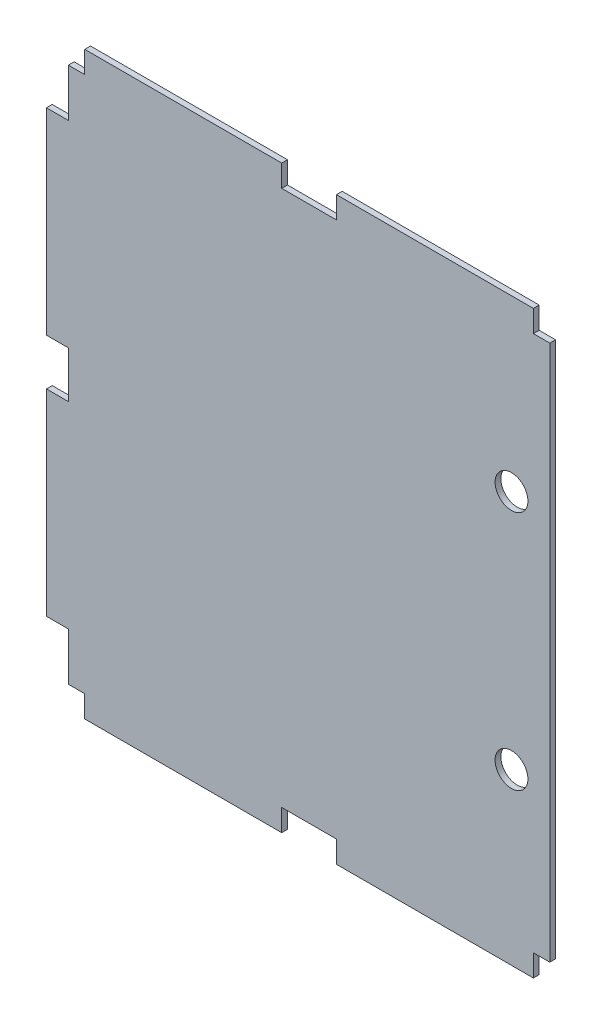
from build123d import *

# Parameters (mm, degrees)
SKETCH1_W           = 279.4
SKETCH1_H           = 311.15
SKETCH1_W_2         = 114.3
SKETCH1_H_2         = 12.7
SKETCH1_W_3         = 12.7
SKETCH1_H_3         = 114.3
BOSS_EXTRUDE1_DEPTH = 3.3528
SKETCH2_R           = 9.525
CUT_EXTRUDE1_DEPTH  = 6.7056


with BuildPart() as part:
    # Sketch1 → Boss-Extrude1 (new body)
    with BuildSketch(Plane.XY):
        Rectangle(SKETCH1_W, SKETCH1_H)
        with Locations((-73.025, -161.925)):
            Rectangle(SKETCH1_W_2, SKETCH1_H_2)
        with Locations((73.025, -161.925)):
            Rectangle(SKETCH1_W_2, SKETCH1_H_2)
        with Locations((-146.05, -70.64375)):
            Rectangle(SKETCH1_W_3, SKETCH1_H_3)
        with Locations((-146.05, 70.64375)):
            Rectangle(SKETCH1_W_3, SKETCH1_H_3)
        with Locations((73.025, 161.925)):
            Rectangle(SKETCH1_W_2, SKETCH1_H_2)
        with Locations((-73.025, 161.925)):
            Rectangle(SKETCH1_W_2, SKETCH1_H_2)
    extrude(amount=BOSS_EXTRUDE1_DEPTH)

    # Sketch2 → Cut-Extrude1 (cut)
    with BuildSketch(Plane.XY.offset(3.3528)):
        with Locations((117.475, 69.85)):
            Circle(SKETCH2_R)
        with Locations((117.475, -69.85)):
            Circle(SKETCH2_R)
    extrude(amount=-CUT_EXTRUDE1_DEPTH, mode=Mode.SUBTRACT)


solid = part.part
